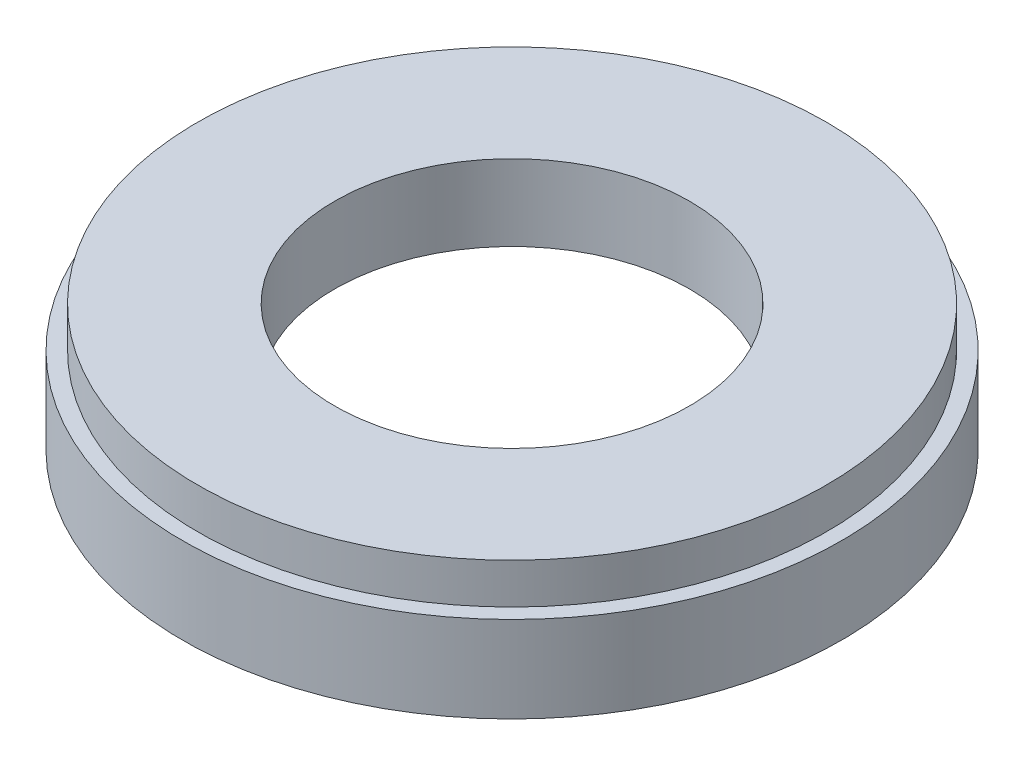
from build123d import *

# Parameters (mm, degrees)
SZKIC1_W = 3
SZKIC1_H = 10


with BuildPart() as part:
    # Szkic1 → Obrót1 (revolve)
    with BuildSketch(Plane.XY, mode=Mode.PRIVATE) as obr_t1_sk:
        Polygon((-62, 0), (-35, 0), (-35, 15), (-62, 15), (-62, 7), (-65, 7), (-65, 0), align=None)
        with Locations((-63.5, -5)):
            Rectangle(SZKIC1_W, SZKIC1_H)
    revolve(obr_t1_sk.sketch.rotate(Axis((0, 0, 0), (0, 1, 0)), 270), axis=Axis((0, 0, 0), (0, 1, 0)))


solid = part.part
